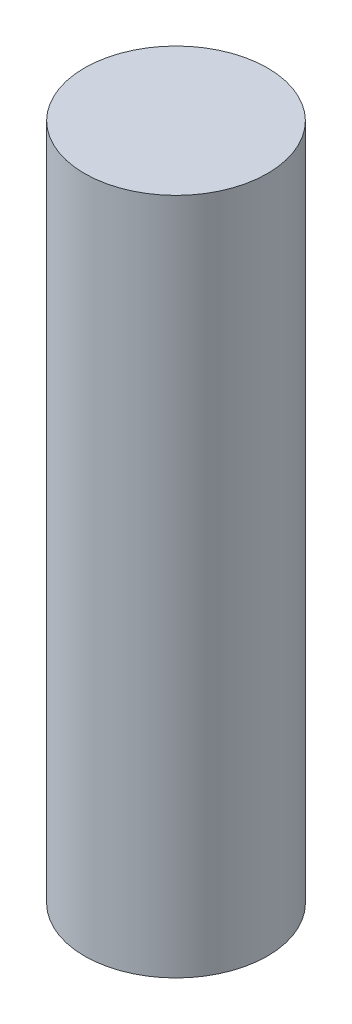
from build123d import *

# Parameters (mm, degrees)
SKETCH2_R = 6.75


with BuildPart() as part:
    # Sweep1: sweep along a path in Sketch1
    with BuildLine(Plane.XY) as sweep1_path:
        Line((0, 0), (0, 50))
    # Sketch2 → Sweep1 (sweep)
    with BuildSketch(Plane(origin=(0, 0, 0), x_dir=(1, 0, 0), z_dir=(0, 1, 0))):
        Circle(SKETCH2_R)
    sweep(path=sweep1_path.line)


solid = part.part
